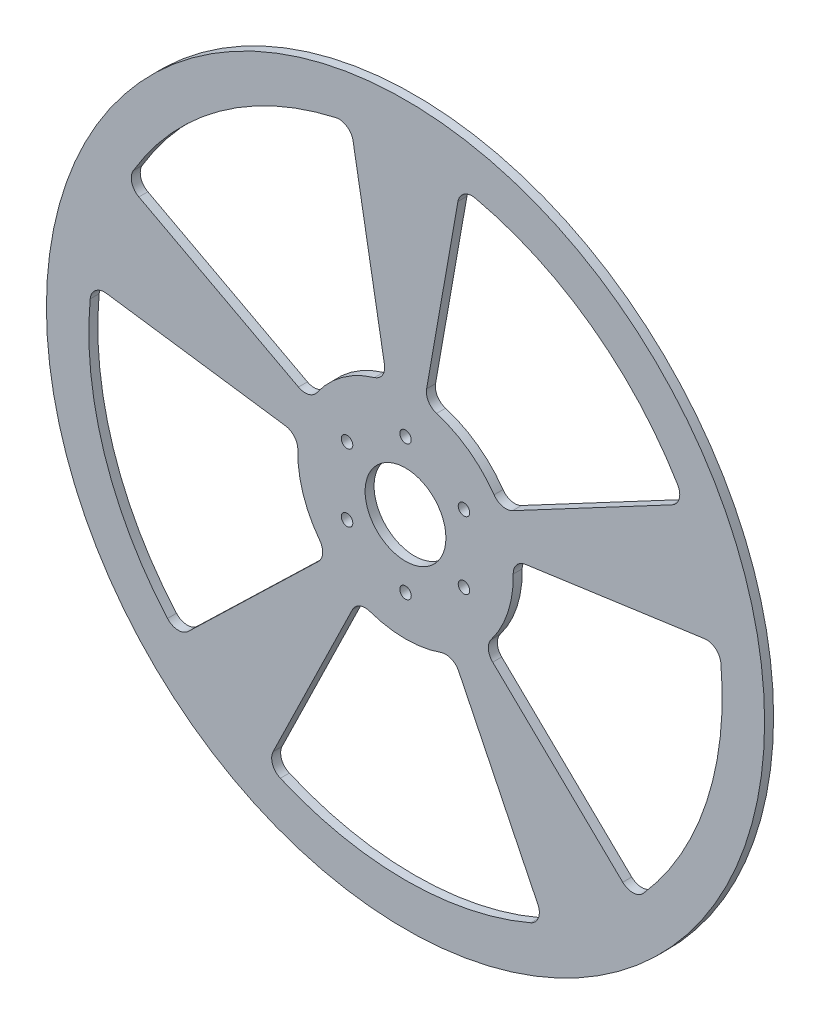
from build123d import *

# Parameters (mm, degrees)
SKETCH1_R           = 127
SKETCH1_R_2         = 14.2875
SKETCH1_R_3         = 2.032
BOSS_EXTRUDE2_DEPTH = 3.175
FILLET1_R           = 5.08
FILLET3_R           = 5.08


with BuildPart() as part:
    # Sketch1 → Boss-Extrude2 (new body)
    with BuildSketch(Plane.XY):
        Circle(SKETCH1_R)
        Circle(SKETCH1_R_2, mode=Mode.SUBTRACT)
        with Locations((0, 23.876)):
            Circle(SKETCH1_R_3, mode=Mode.SUBTRACT)
        with Locations((20.677222541, 11.938)):
            Circle(SKETCH1_R_3, mode=Mode.SUBTRACT)
        with Locations((20.677222541, -11.938)):
            Circle(SKETCH1_R_3, mode=Mode.SUBTRACT)
        with Locations((0, -23.876)):
            Circle(SKETCH1_R_3, mode=Mode.SUBTRACT)
        with Locations((-20.677222541, -11.938)):
            Circle(SKETCH1_R_3, mode=Mode.SUBTRACT)
        with Locations((-20.677222541, 11.938)):
            Circle(SKETCH1_R_3, mode=Mode.SUBTRACT)
        with BuildLine():
            Line((19.448595899, 110.298468337), (6.615995569, 37.52117539))
            ThreePointArc((6.615995569, 37.52117539), (22.394618112, 30.823547486), (33.640303288, 17.886866542))
            Line((33.640303288, 17.886866542), (98.8901304, 52.580815032))
            ThreePointArc((98.8901304, 52.580815032), (65.831948257, 90.60990337), (19.448595899, 110.298468337))
        make_face(mode=Mode.SUBTRACT)
        with BuildLine():
            Line((-6.615995569, 37.52117539), (-19.448595899, 110.298468337))
            ThreePointArc((-19.448595899, 110.298468337), (-65.831948257, 90.60990337), (-98.8901304, 52.580815032))
            Line((-98.8901304, 52.580815032), (-33.640303288, 17.886866542))
            ThreePointArc((-33.640303288, 17.886866542), (-22.394618112, 30.823547486), (-6.615995569, 37.52117539))
        make_face(mode=Mode.SUBTRACT)
        with BuildLine():
            Line((37.729213419, 5.302495147), (110.910023699, 15.587387308))
            ThreePointArc((110.910023699, 15.587387308), (106.518329825, -34.60990337), (80.566057638, -77.801737491))
            Line((80.566057638, -77.801737491), (27.406846393, -26.466483914))
            ThreePointArc((27.406846393, -26.466483914), (36.235253271, -11.773547486), (37.729213419, 5.302495147))
        make_face(mode=Mode.SUBTRACT)
        with BuildLine():
            Line((49.09756844, -100.664933186), (16.701940693, -34.244053164))
            ThreePointArc((16.701940693, -34.244053164), (0, -38.1), (-16.701940693, -34.244053164))
            Line((-16.701940693, -34.244053164), (-49.09756844, -100.664933186))
            ThreePointArc((-49.09756844, -100.664933186), (0, -112), (49.09756844, -100.664933186))
        make_face(mode=Mode.SUBTRACT)
        with BuildLine():
            Line((-80.566057638, -77.801737491), (-27.406846393, -26.466483914))
            ThreePointArc((-27.406846393, -26.466483914), (-36.235253271, -11.773547486), (-37.729213419, 5.302495147))
            Line((-37.729213419, 5.302495147), (-110.910023699, 15.587387308))
            ThreePointArc((-110.910023699, 15.587387308), (-106.518329825, -34.60990337), (-80.566057638, -77.801737491))
        make_face(mode=Mode.SUBTRACT)
    extrude(amount=BOSS_EXTRUDE2_DEPTH)

    # Fillet1
    fillet1_edges = [part.edges().sort_by_distance(p)[0] for p in [
        (98.8901304, 52.580815032, 1.5875),
        (19.448595899, 110.298468337, 1.5875),
        (6.615995569, 37.52117539, 1.5875),
        (33.640303288, 17.886866542, 1.5875),
    ]]
    fillet(fillet1_edges, radius=FILLET1_R)

    # Fillet3
    fillet3_edges = [part.edges().sort_by_distance(p)[0] for p in [
        (-33.640303288, 17.886866542, 1.5875),
        (-6.615995569, 37.52117539, 1.5875),
        (-19.448595899, 110.298468337, 1.5875),
        (-98.8901304, 52.580815032, 1.5875),
        (37.729213419, 5.302495147, 1.5875),
        (27.406846393, -26.466483914, 1.5875),
        (80.566057638, -77.801737491, 1.5875),
        (110.910023699, 15.587387308, 1.5875),
        (-49.09756844, -100.664933186, 1.5875),
        (49.09756844, -100.664933186, 1.5875),
        (16.701940693, -34.244053164, 1.5875),
        (-16.701940693, -34.244053164, 1.5875),
        (-110.910023699, 15.587387308, 1.5875),
        (-80.566057638, -77.801737491, 1.5875),
        (-27.406846393, -26.466483914, 1.5875),
        (-37.729213419, 5.302495147, 1.5875),
    ]]
    fillet(fillet3_edges, radius=FILLET3_R)


solid = part.part
